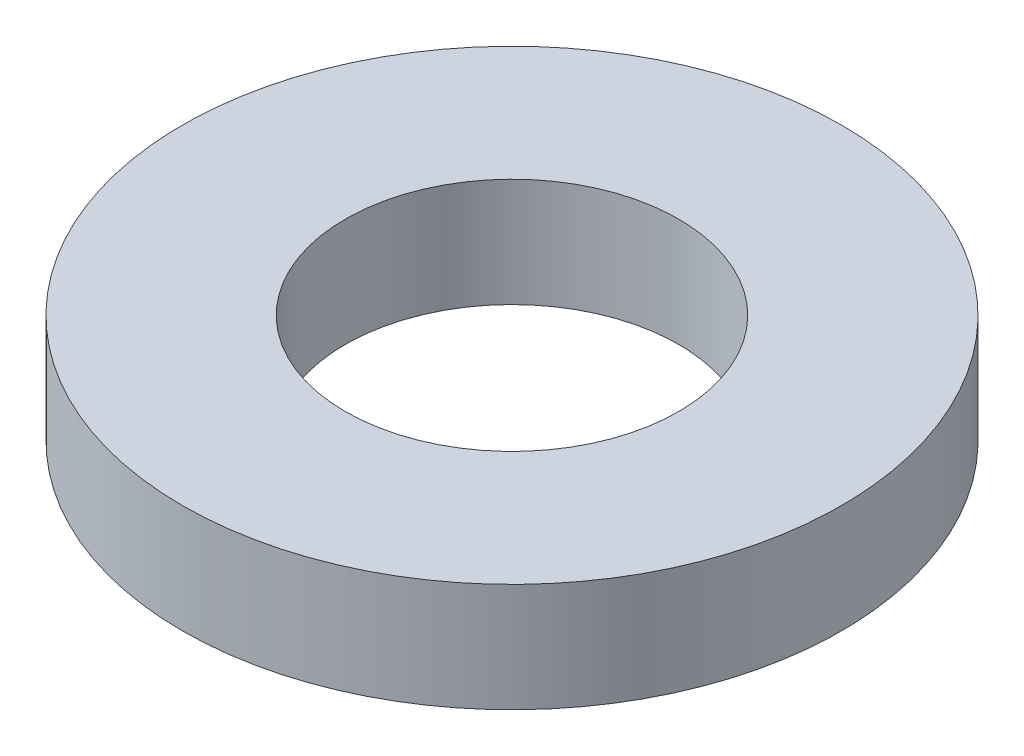
from build123d import *

# Parameters (mm, degrees)
SKETCH_1_R      = 4.25
SKETCH_1_R_2    = 2.15
EXTRUDE_1_DEPTH = 1.4


with BuildPart() as part:
    # 草图1 → 凸台-拉伸1 (new body)
    with BuildSketch(Plane(origin=(0, 0, 0), x_dir=(1, 0, 0), z_dir=(0, 1, 0))):
        with Locations(Location((0, 0, 0), (0, 0, 270))):
            Circle(SKETCH_1_R)
        with Locations(Location((0, 0, 0), (0, 0, 270))):
            Circle(SKETCH_1_R_2, mode=Mode.SUBTRACT)
    extrude(amount=EXTRUDE_1_DEPTH)


solid = part.part
